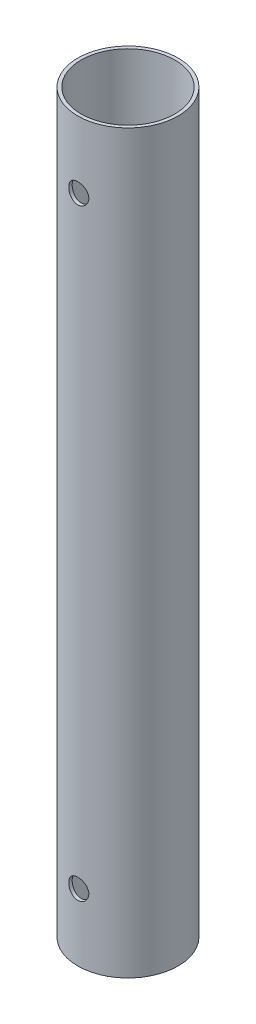
from build123d import *

# Parameters (mm, degrees)
SKETCH1_R           = 15
SKETCH1_R_2         = 14
BOSS_EXTRUDE1_DEPTH = 220
SKETCH2_R           = 3
CUT_EXTRUDE1_DEPTH  = 15


with BuildPart() as part:
    # Sketch1 → Boss-Extrude1 (new body)
    with BuildSketch(Plane(origin=(0, 0, 0), x_dir=(1, 0, 0), z_dir=(0, 1, 0))):
        with Locations(Location((0, 0, 0), (0, 0, 270))):
            Circle(SKETCH1_R)
        with Locations(Location((0, 0, 0), (0, 0, 270))):
            Circle(SKETCH1_R_2, mode=Mode.SUBTRACT)
    extrude(amount=BOSS_EXTRUDE1_DEPTH)

    # Sketch2 → Cut-Extrude1 (cut, symmetric)
    with BuildSketch(Plane.XY):
        with Locations((0, 200)):
            Circle(SKETCH2_R)
        with Locations((0, 20)):
            Circle(SKETCH2_R)
    extrude(amount=CUT_EXTRUDE1_DEPTH, both=True, mode=Mode.SUBTRACT)


solid = part.part
